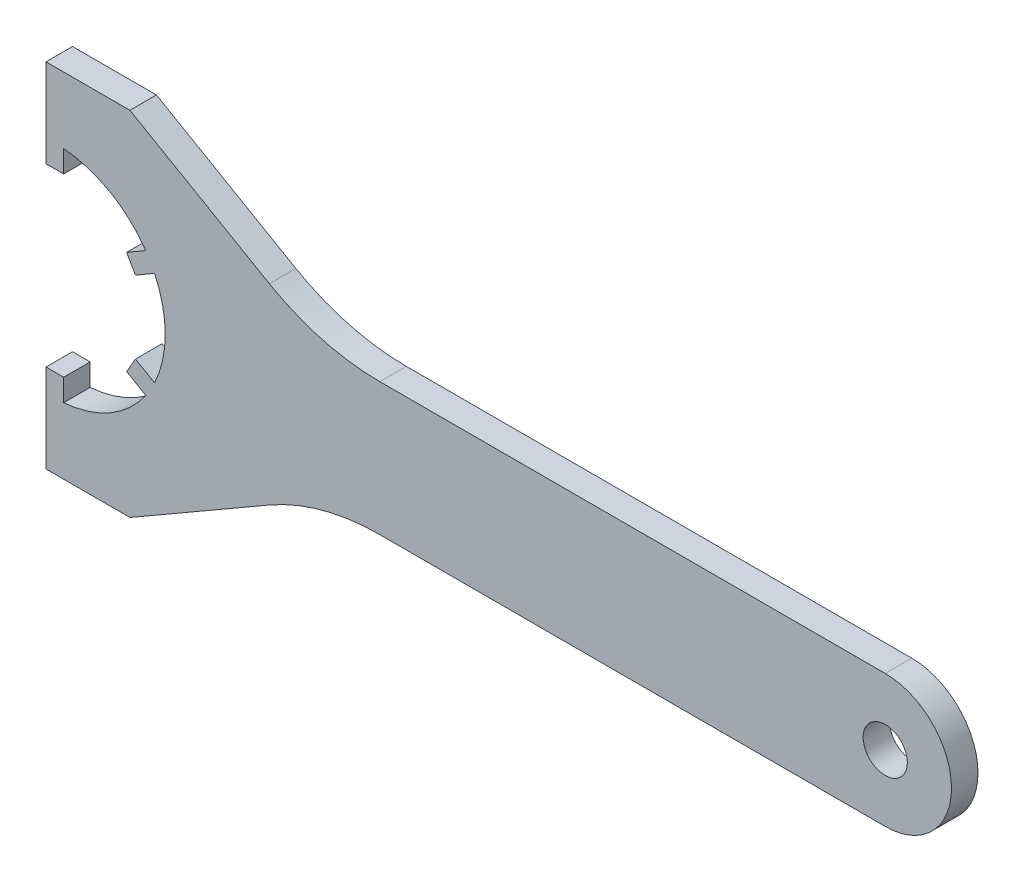
from build123d import *

# Parameters (mm, degrees)
SKETCH1_R           = 5
BOSS_EXTRUDE1_DEPTH = 3
FILLET1_R           = 50


with BuildPart() as part:
    # Sketch1 → Boss-Extrude1 (new, symmetric)
    with BuildSketch(Plane.XY):
        with BuildLine():
            Line((2, 24.919871589), (2, 19.919871589))
            Line((2, 19.919871589), (-2, 19.919871589))
            Line((-2, 19.919871589), (-2, 24.919871589))
            Line((-2, 24.919871589), (-2, 39.919871589))
            Line((-2, 39.919871589), (17, 39.919871589))
            Line((17, 39.919871589), (60.16248371, 15))
            Line((60.16248371, 15), (188, 15))
            ThreePointArc((188, 15), (203, 0), (188, -15))
            Line((188, -15), (60.16248371, -15))
            Line((60.16248371, -15), (17, -39.919871589))
            Line((17, -39.919871589), (-2, -39.919871589))
            Line((-2, -39.919871589), (-2, -24.919871589))
            Line((-2, -24.919871589), (-2, -19.919871589))
            Line((-2, -19.919871589), (2, -19.919871589))
            Line((2, -19.919871589), (2, -24.919871589))
            ThreePointArc((2, -24.919871589), (12.5, -21.650635095), (20.581241855, -14.191986602))
            Line((20.581241855, -14.191986602), (16.251114836, -11.691986602))
            Line((16.251114836, -11.691986602), (18.251114836, -8.227884987))
            Line((18.251114836, -8.227884987), (22.581241855, -10.727884987))
            ThreePointArc((22.581241855, -10.727884987), (25, 0), (22.581241855, 10.727884987))
            Line((22.581241855, 10.727884987), (18.251114836, 8.227884987))
            Line((18.251114836, 8.227884987), (16.251114836, 11.691986602))
            Line((16.251114836, 11.691986602), (20.581241855, 14.191986602))
            ThreePointArc((20.581241855, 14.191986602), (12.5, 21.650635095), (2, 24.919871589))
        make_face()
        with Locations((188, 0)):
            Circle(SKETCH1_R, mode=Mode.SUBTRACT)
    extrude(amount=BOSS_EXTRUDE1_DEPTH, both=True)

    # Fillet1
    fillet1_edges = [part.edges().sort_by_distance(p)[0] for p in [
        (60.16248371, -15, 0),
        (60.16248371, 15, 0),
    ]]
    fillet(fillet1_edges, radius=FILLET1_R)


solid = part.part
